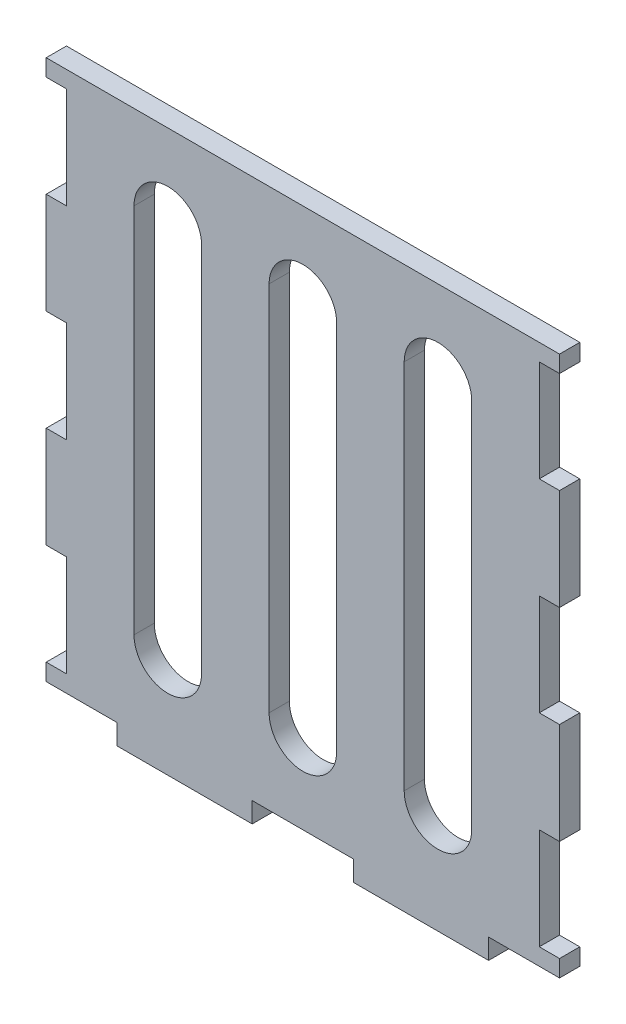
from build123d import *

# Parameters (mm, degrees)
SKETCH1_W           = 20
SKETCH1_H           = 3
BOSS_EXTRUDE1_DEPTH = 3


with BuildPart() as part:
    # Sketch1 → Boss-Extrude1 (new body)
    # profile 1 of 3: a face of its own
    with BuildSketch(Plane.XY):
        Polygon((35, 40), (-35, 40), (-38, 40), (-38, 37.5), (-35, 37.5), (-35, 22.5), (-38, 22.5), (-38, 7.5), (-35, 7.5), (-35, -7.5), (-38, -7.5), (-38, -22.5), (-35, -22.5), (-35, -37.5), (-38, -37.5), (-38, -40), (-27.5, -40), (-7.5, -40), (7.5, -40), (27.5, -40), (38, -40), (38, -37.5), (35, -37.5), (35, -22.5), (38, -22.5), (38, -7.5), (35, -7.5), (35, 7.5), (38, 7.5), (38, 22.5), (35, 22.5), (35, 37.5), (38, 37.5), (38, 40), align=None)
        with BuildLine():
            Line((-15, 27.5), (-15, -27.5))
            ThreePointArc((-15, -27.5), (-20, -32.5), (-25, -27.5))
            Line((-25, -27.5), (-25, 27.5))
            ThreePointArc((-25, 27.5), (-20, 32.5), (-15, 27.5))
        make_face(mode=Mode.SUBTRACT)
        with BuildLine():
            ThreePointArc((5, -27.5), (0, -32.5), (-5, -27.5))
            Line((-5, -27.5), (-5, 27.5))
            ThreePointArc((-5, 27.5), (0, 32.5), (5, 27.5))
            Line((5, 27.5), (5, -27.5))
        make_face(mode=Mode.SUBTRACT)
        with BuildLine():
            ThreePointArc((25, -27.5), (20, -32.5), (15, -27.5))
            Line((15, -27.5), (15, 27.5))
            ThreePointArc((15, 27.5), (20, 32.5), (25, 27.5))
            Line((25, 27.5), (25, -27.5))
        make_face(mode=Mode.SUBTRACT)
    # profile 2 of 3: a face of its own
    with BuildSketch(Plane.XY):
        with Locations((17.5, -41.5)):
            Rectangle(SKETCH1_W, SKETCH1_H)
    # profile 3 of 3: a face of its own
    with BuildSketch(Plane.XY):
        with Locations((-17.5, -41.5)):
            Rectangle(SKETCH1_W, SKETCH1_H)
    extrude(amount=BOSS_EXTRUDE1_DEPTH)


solid = part.part
